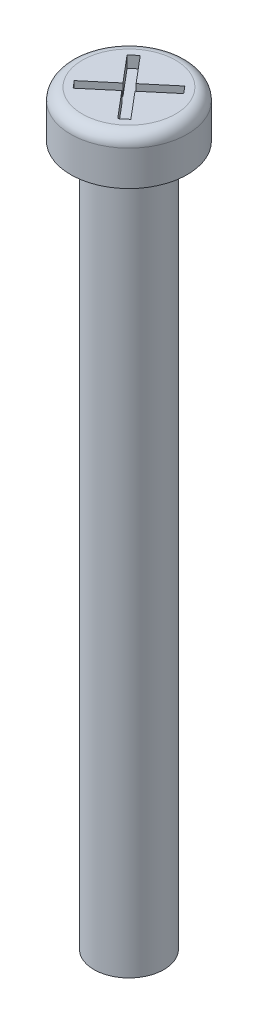
from build123d import *

# Parameters (mm, degrees)
CORTE_EXTRUS_O1_DEPTH = 0.5


with BuildPart() as part:
    # Esboço1 → Revolução1 (revolve)
    with BuildSketch(Plane.XY, mode=Mode.PRIVATE) as revolu_o1_sk:
        with BuildLine():
            Line((0, 32), (2, 32))
            ThreePointArc((2, 32), (2.353553391, 31.853553391), (2.5, 31.5))
            Line((2.5, 31.5), (2.5, 30))
            Line((2.5, 30), (1.5, 30))
            Line((1.5, 30), (1.5, 0))
            Line((1.5, 0), (0, 0))
            Line((0, 0), (0, 32))
        make_face()
    revolve(revolu_o1_sk.sketch.rotate(Axis((0, 32, 0), (0, -1, 0)), 180), axis=Axis((0, 32, 0), (0, -1, 0)))

    # Esboço2 → Corte-extrusão1 (cut)
    with BuildSketch(Plane(origin=(0, 32, 0), x_dir=(1, 0, 0), z_dir=(0, 1, 0))):
        Polygon((-1.236731601, 1.156201078), (-0.281827121, 0.023947316), (-1.414080883, -0.930957165), (-1.156201078, -1.236731601), (-0.023947316, -0.281827121), (0.930957165, -1.414080883), (1.236731601, -1.156201078), (0.281827121, -0.023947316), (1.414080883, 0.930957165), (1.156201078, 1.236731601), (0.023947316, 0.281827121), (-0.930957165, 1.414080883), align=None)
    extrude(amount=-CORTE_EXTRUS_O1_DEPTH, mode=Mode.SUBTRACT)


solid = part.part
